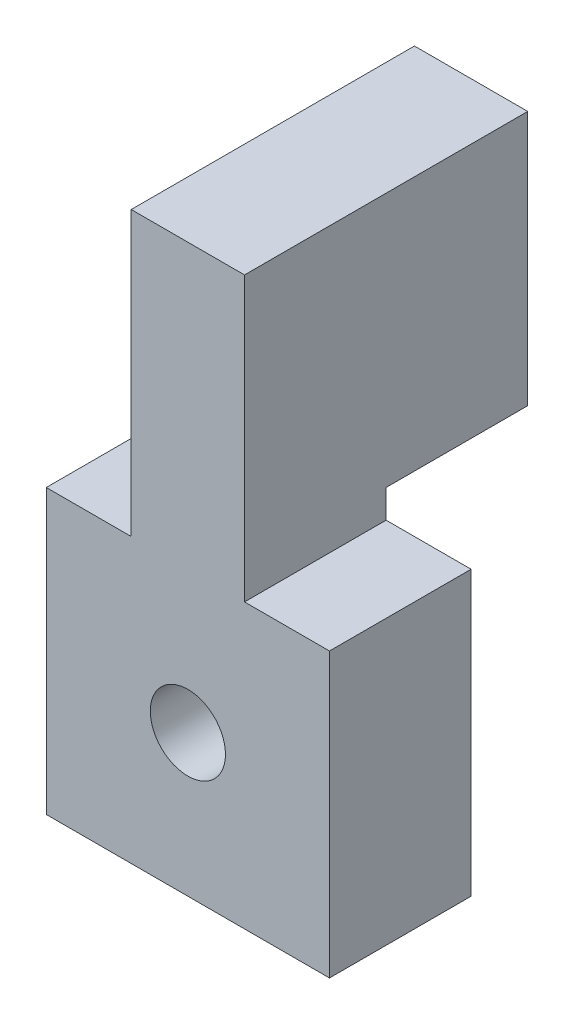
from build123d import *

# Parameters (mm, degrees)
SKETCH1_W                  = 20
SKETCH1_H                  = 20
SKETCH1_W_2                = 8
BOSS_EXTRUDE1_DEPTH        = 10
F_4_0_209_DIAMETER_HOLE1_D = 5.3086
SKETCH1_3_W                = 8
SKETCH1_3_H                = 20
BOSS_EXTRUDE2_DEPTH        = 10
SKETCH4_W                  = 8
SKETCH4_H                  = 2
CUT_EXTRUDE1_DEPTH         = 10


with BuildPart() as part:
    # Sketch1 → Boss-Extrude1 (new body)
    with BuildSketch(Plane.XY):
        Rectangle(SKETCH1_W, SKETCH1_H)
        with Locations((0, 20)):
            Rectangle(SKETCH1_W_2, SKETCH1_H)
    extrude(amount=BOSS_EXTRUDE1_DEPTH)

    # #4 (0.209) Diameter Hole1 (through all)
    with Locations(Plane.XY.offset(10)):
        with Locations((0, 0)):
            Hole(F_4_0_209_DIAMETER_HOLE1_D / 2)

    # Sketch1<3> → Boss-Extrude2 (add)
    with BuildSketch(Plane.XY):
        with Locations((0, 20)):
            Rectangle(SKETCH1_3_W, SKETCH1_3_H)
    extrude(amount=-BOSS_EXTRUDE2_DEPTH)

    # Sketch4 → Cut-Extrude1 (cut)
    with BuildSketch(Plane(origin=(0, 0, -10), x_dir=(-1, 0, 0), z_dir=(0, 0, -1))):
        with Locations((0, 11)):
            Rectangle(SKETCH4_W, SKETCH4_H)
    extrude(amount=-CUT_EXTRUDE1_DEPTH, mode=Mode.SUBTRACT)


solid = part.part
